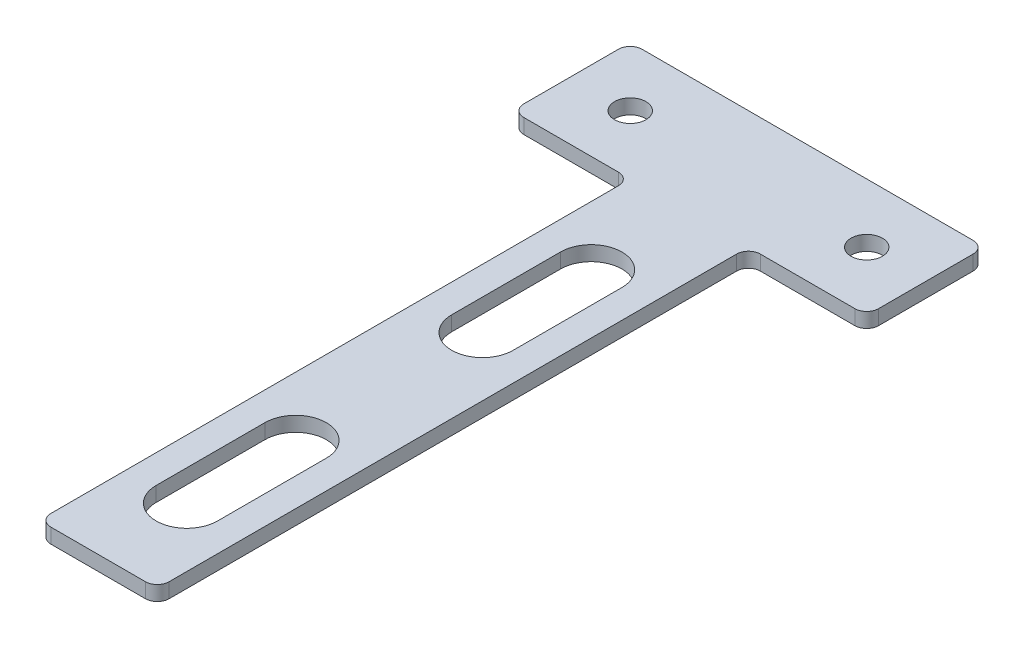
from build123d import *

# Parameters (mm, degrees)
SKETCH1_W           = 25.4
SKETCH1_H           = 25.4
BOSS_EXTRUDE1_DEPTH = 3.175
SKETCH2_R           = 3.3734375
CUT_EXTRUDE1_DEPTH  = 3.175
FILLET1_R           = 2.54


with BuildPart() as part:
    # Sketch1 → Boss-Extrude1 (new body)
    with BuildSketch(Plane(origin=(0, 0, 0), x_dir=(1, 0, 0), z_dir=(0, 1, 0))):
        with Locations((-25.4, 63.5)):
            Rectangle(SKETCH1_W, SKETCH1_H)
        Polygon((-12.7, -76.2), (12.7, -76.2), (12.7, 50.8), (12.7, 76.2), (-12.7, 76.2), (-12.7, 50.8), align=None)
        with Locations((25.4, 63.5)):
            Rectangle(SKETCH1_W, SKETCH1_H)
    extrude(amount=BOSS_EXTRUDE1_DEPTH)

    # Sketch2 → Cut-Extrude1 (cut)
    with BuildSketch(Plane(origin=(0, 3.175, 0), x_dir=(1, 0, 0), z_dir=(0, 1, 0))):
        with Locations(Location((-25.4, 63.5, 0), (0, 0, 270))):
            Circle(SKETCH2_R)
        with Locations(Location((25.4, 63.5, 0), (0, 0, 270))):
            Circle(SKETCH2_R)
        with BuildLine():
            Line((6.604, 29.718), (6.604, 6.35))
            ThreePointArc((6.604, 6.35), (0, -0.254), (-6.604, 6.35))
            Line((-6.604, 6.35), (-6.604, 29.718))
            ThreePointArc((-6.604, 29.718), (0, 36.322), (6.604, 29.718))
        make_face()
        with BuildLine():
            Line((6.604, -33.782), (6.604, -57.15))
            ThreePointArc((6.604, -57.15), (0, -63.754), (-6.604, -57.15))
            Line((-6.604, -57.15), (-6.604, -33.782))
            ThreePointArc((-6.604, -33.782), (0, -27.178), (6.604, -33.782))
        make_face()
    extrude(amount=-CUT_EXTRUDE1_DEPTH, mode=Mode.SUBTRACT)

    # Fillet1
    fillet1_edges = [part.edges().sort_by_distance(p)[0] for p in [
        (38.1, 1.5875, -76.2),
        (38.1, 1.5875, -50.8),
        (12.7, 1.5875, -50.8),
        (12.7, 1.5875, 76.2),
        (-12.7, 1.5875, 76.2),
        (-12.7, 1.5875, -50.8),
        (-38.1, 1.5875, -50.8),
        (-38.1, 1.5875, -76.2),
    ]]
    fillet(fillet1_edges, radius=FILLET1_R)


solid = part.part
